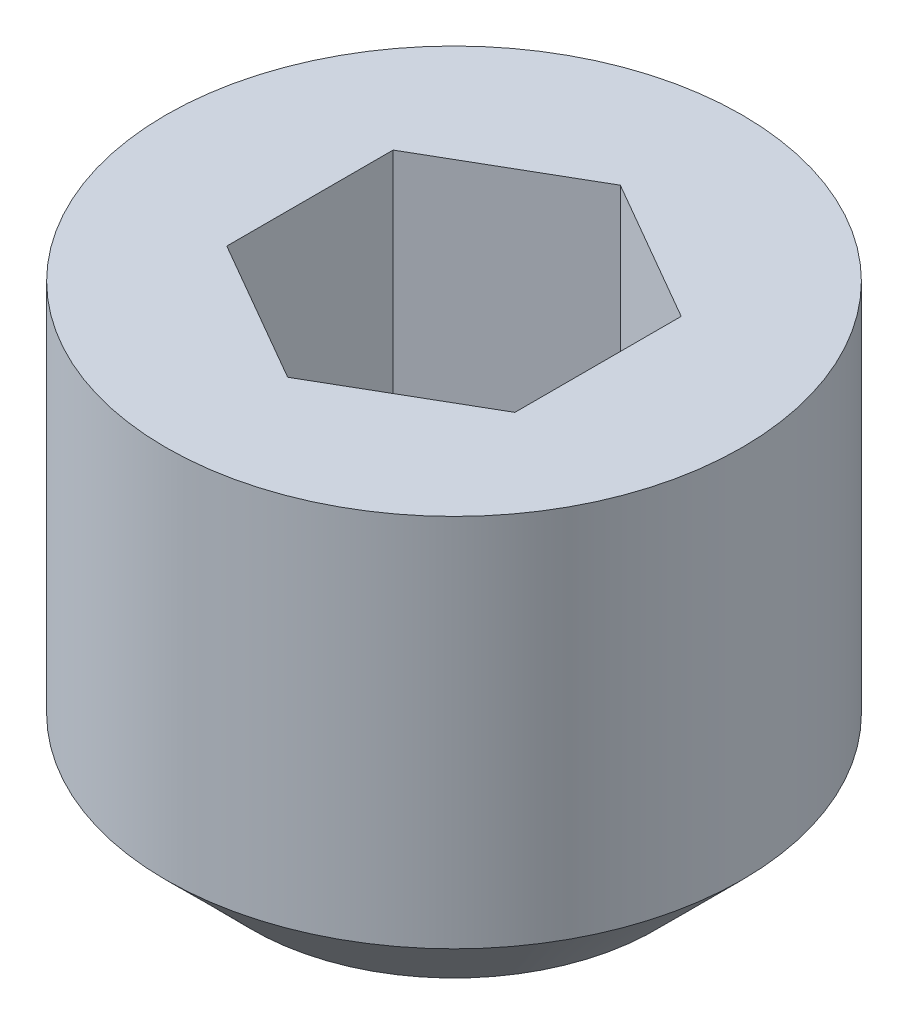
from build123d import *

# Parameters (mm, degrees)
SKETCH1_W          = 2.5
SKETCH1_H          = 4
CUT_EXTRUDE1_DEPTH = 2


with BuildPart() as part:
    # Sketch1 → Revolve1 (revolve)
    with BuildSketch(Plane.XY, mode=Mode.PRIVATE) as revolve1_sk:
        with Locations((1.25, 2)):
            Rectangle(SKETCH1_W, SKETCH1_H)
    revolve(revolve1_sk.sketch.rotate(Axis((0, 4, 0), (0, -1, 0)), 180), axis=Axis((0, 4, 0), (0, -1, 0)))

    # Sketch2 → Cut-Revolve1 (revolve, cut)
    with BuildSketch(Plane.XY, mode=Mode.PRIVATE) as cut_revolve1_sk:
        Polygon((0, 4), (1.25, 4), (1.25, 2), (0, 1.278312164), align=None)
    revolve(cut_revolve1_sk.sketch.rotate(Axis((0, 4, 0), (0, -1, 0)), 180), axis=Axis((0, 4, 0), (0, -1, 0)), mode=Mode.SUBTRACT)

    # Sketch3 → Cut-Extrude1 (cut)
    with BuildSketch(Plane(origin=(0, 4, 0), x_dir=(1, 0, 0), z_dir=(0, 1, 0))):
        Polygon((0, 1.443375673), (-1.25, 0.721687836), (-1.25, -0.721687836), (0, -1.443375673), (1.25, -0.721687836), (1.25, 0.721687836), align=None)
    extrude(amount=-CUT_EXTRUDE1_DEPTH, mode=Mode.SUBTRACT)

    # Sketch4 → Cut-Revolve2 (revolve, cut)
    with BuildSketch(Plane.XY, mode=Mode.PRIVATE) as cut_revolve2_sk:
        Polygon((2.5, 0.75), (2.5, 0), (1.75, 0), align=None)
    revolve(cut_revolve2_sk.sketch.rotate(Axis((0, 4, 0), (0, -1, 0)), 180), axis=Axis((0, 4, 0), (0, -1, 0)), mode=Mode.SUBTRACT)


solid = part.part
